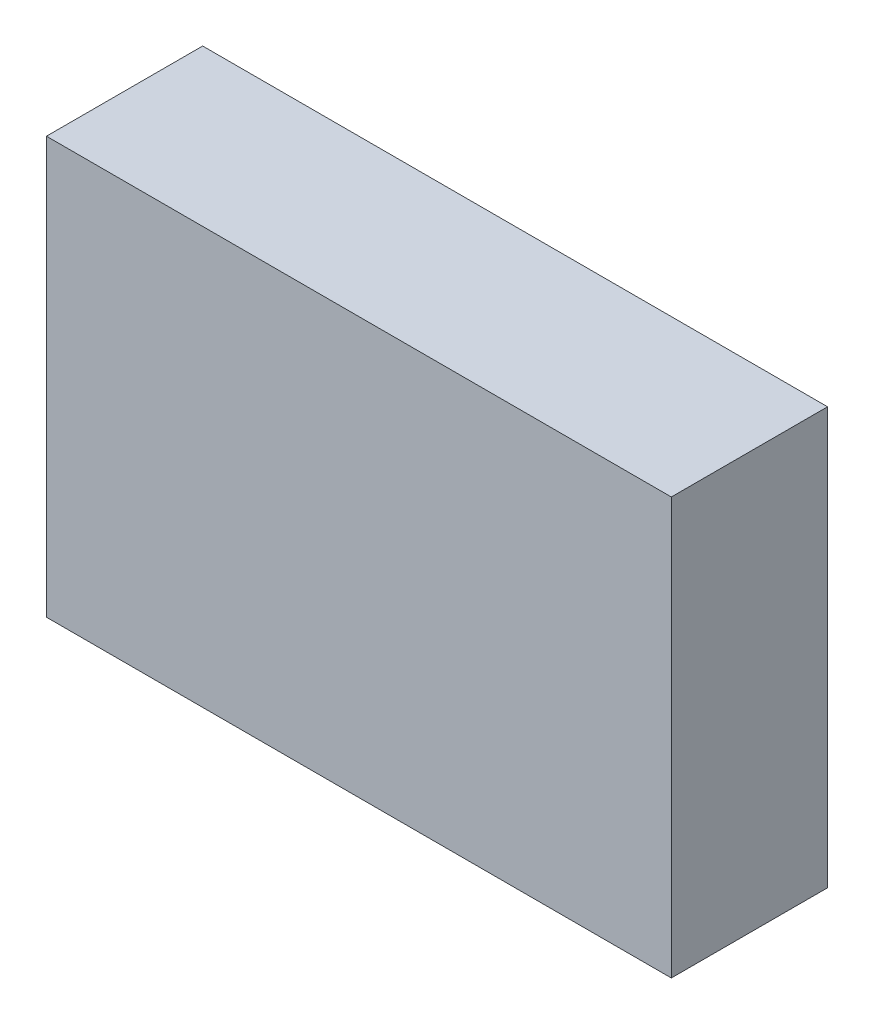
from build123d import *

# Parameters (mm, degrees)
SKETCH_1_W          = 60
SKETCH_1_H          = 40
EXTRUDE_1_DEPTH     = 15
SKETCH_2_W          = 56
SKETCH_2_H          = 36
CUT_EXTRUDE_1_DEPTH = 13


with BuildPart() as part:
    # 草圖1 → 填料-伸長1 (new body)
    with BuildSketch(Plane.XY):
        with Locations((-30, 20)):
            Rectangle(SKETCH_1_W, SKETCH_1_H)
    extrude(amount=EXTRUDE_1_DEPTH)

    # 草圖2 → 除料-伸長1 (cut)
    with BuildSketch(Plane(origin=(0, 0, 0), x_dir=(-1, 0, 0), z_dir=(0, 0, -1))):
        with Locations((30, 20)):
            Rectangle(SKETCH_2_W, SKETCH_2_H)
    extrude(amount=-CUT_EXTRUDE_1_DEPTH, mode=Mode.SUBTRACT)


solid = part.part
